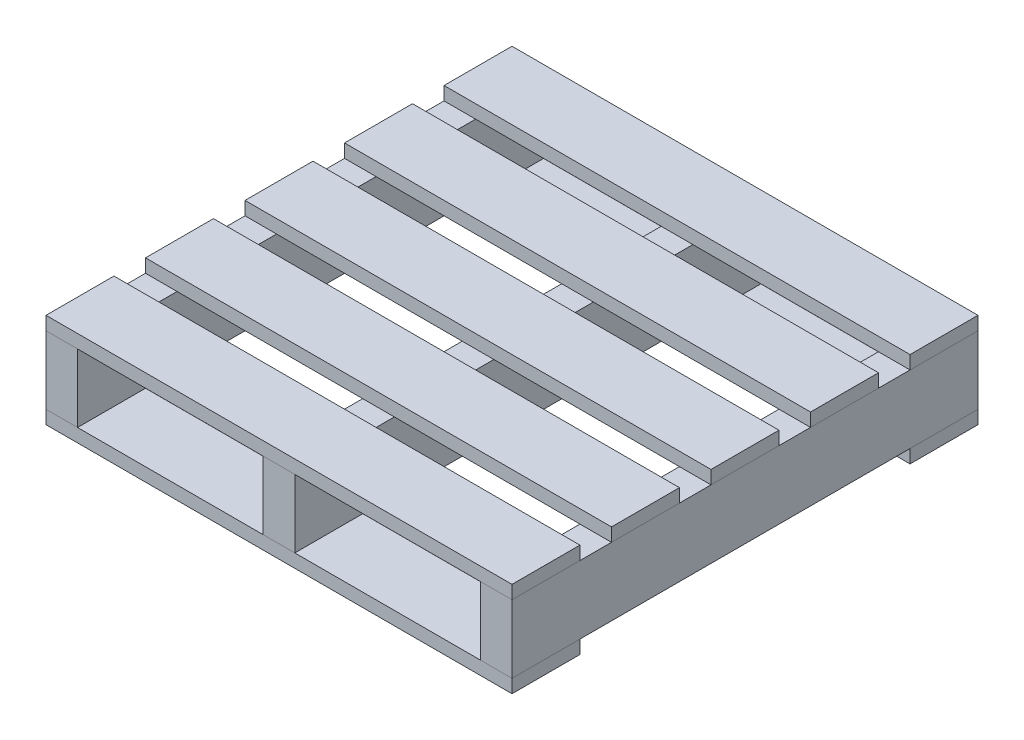
from build123d import *

# Parameters (mm, degrees)
BOSS_EXTRUDE1_DEPTH        = 304.8
BOSS_EXTRUDE1_DEPTH_BACK   = 304.8
SKETCH3_W                  = 41.275
SKETCH3_H                  = 89.0016
BOSS_EXTRUDE1_2_DEPTH      = 304.8
BOSS_EXTRUDE1_2_DEPTH_BACK = 304.8
SKETCH3_W_2                = 41.402
BOSS_EXTRUDE1_3_DEPTH      = 304.8
BOSS_EXTRUDE1_3_DEPTH_BACK = 304.8
SKETCH4_W                  = 609.6
SKETCH4_H                  = 88.9
BOSS_EXTRUDE2_DEPTH        = 17.4752
BOSS_EXTRUDE2_2_DEPTH      = 17.4752
BOSS_EXTRUDE2_3_DEPTH      = 17.4752
BOSS_EXTRUDE2_4_DEPTH      = 17.4752
BOSS_EXTRUDE2_5_DEPTH      = 17.4752
SKETCH5_W                  = 609.6
SKETCH5_H                  = 88.9
BOSS_EXTRUDE3_DEPTH        = 17.4752
BOSS_EXTRUDE3_2_DEPTH      = 17.4752


with BuildPart() as part:
    # Sketch3 → Boss-Extrude1 (new, two sides: drawn at the far end of the back side and taken through both)
    with BuildSketch(Plane.XY.offset(-BOSS_EXTRUDE1_DEPTH_BACK)):
        with Locations((-284.1625, 0)):
            Rectangle(SKETCH3_W, SKETCH3_H)
    extrude(amount=BOSS_EXTRUDE1_DEPTH + BOSS_EXTRUDE1_DEPTH_BACK)


with BuildPart() as body_2:
    # Sketch3 → Boss-Extrude1 2 (new, two sides: drawn at the far end of the back side and taken through both)
    with BuildSketch(Plane.XY.offset(-BOSS_EXTRUDE1_2_DEPTH_BACK)):
        Rectangle(SKETCH3_W_2, SKETCH3_H)
    extrude(amount=BOSS_EXTRUDE1_2_DEPTH + BOSS_EXTRUDE1_2_DEPTH_BACK)


with BuildPart() as body_3:
    # Sketch3 → Boss-Extrude1 3 (new, two sides: drawn at the far end of the back side and taken through both)
    with BuildSketch(Plane.XY.offset(-BOSS_EXTRUDE1_3_DEPTH_BACK)):
        with Locations((284.1625, 0)):
            Rectangle(SKETCH3_W, SKETCH3_H)
    extrude(amount=BOSS_EXTRUDE1_3_DEPTH + BOSS_EXTRUDE1_3_DEPTH_BACK)


with BuildPart() as body_4:
    # Sketch4 → Boss-Extrude2 (new body)
    with BuildSketch(Plane(origin=(0, 44.5008, 0), x_dir=(1, 0, 0), z_dir=(0, 1, 0))):
        with Locations((0, -260.35)):
            Rectangle(SKETCH4_W, SKETCH4_H)
    extrude(amount=BOSS_EXTRUDE2_DEPTH)


with BuildPart() as body_5:
    # Sketch4 → Boss-Extrude2 2 (new body)
    with BuildSketch(Plane(origin=(0, 44.5008, 0), x_dir=(1, 0, 0), z_dir=(0, 1, 0))):
        with Locations((0, -130.175)):
            Rectangle(SKETCH4_W, SKETCH4_H)
    extrude(amount=BOSS_EXTRUDE2_2_DEPTH)


with BuildPart() as body_6:
    # Sketch4 → Boss-Extrude2 3 (new body)
    with BuildSketch(Plane(origin=(0, 44.5008, 0), x_dir=(1, 0, 0), z_dir=(0, 1, 0))):
        Rectangle(SKETCH4_W, SKETCH4_H)
    extrude(amount=BOSS_EXTRUDE2_3_DEPTH)


with BuildPart() as body_7:
    # Sketch4 → Boss-Extrude2 4 (new body)
    with BuildSketch(Plane(origin=(0, 44.5008, 0), x_dir=(1, 0, 0), z_dir=(0, 1, 0))):
        with Locations((0, 130.175)):
            Rectangle(SKETCH4_W, SKETCH4_H)
    extrude(amount=BOSS_EXTRUDE2_4_DEPTH)


with BuildPart() as body_8:
    # Sketch4 → Boss-Extrude2 5 (new body)
    with BuildSketch(Plane(origin=(0, 44.5008, 0), x_dir=(1, 0, 0), z_dir=(0, 1, 0))):
        with Locations((0, 260.35)):
            Rectangle(SKETCH4_W, SKETCH4_H)
    extrude(amount=BOSS_EXTRUDE2_5_DEPTH)


with BuildPart() as body_9:
    # Sketch5 → Boss-Extrude3 (new body)
    with BuildSketch(Plane.XZ.offset(44.5008)):
        with Locations((0, 260.35)):
            Rectangle(SKETCH5_W, SKETCH5_H)
    extrude(amount=BOSS_EXTRUDE3_DEPTH)


with BuildPart() as body_10:
    # Sketch5 → Boss-Extrude3 2 (new body)
    with BuildSketch(Plane.XZ.offset(44.5008)):
        with Locations((0, -260.35)):
            Rectangle(SKETCH5_W, SKETCH5_H)
    extrude(amount=BOSS_EXTRUDE3_2_DEPTH)


solid = Compound([part.part, body_2.part, body_3.part, body_4.part, body_5.part, body_6.part, body_7.part, body_8.part, body_9.part, body_10.part])
